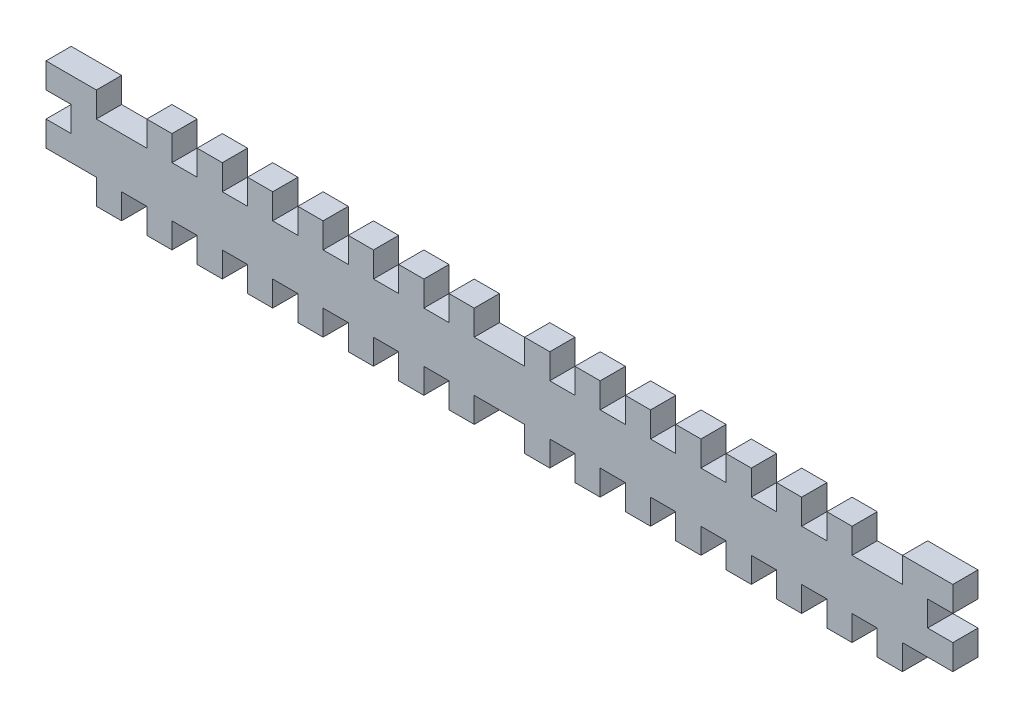
from build123d import *

# Parameters (mm, degrees)
BOSS_EXTRUDE1_DEPTH = 6.35


with BuildPart() as part:
    # Sketch1 → Boss-Extrude1 (new body)
    with BuildSketch(Plane.XY):
        Polygon((-107.95, 0), (-114.3, 0), (-114.3, -6.35), (-101.6, -6.35), (-101.6, -12.7), (-95.25, -12.7), (-95.25, -6.35), (-88.9, -6.35), (-88.9, -12.7), (-82.55, -12.7), (-82.55, -6.35), (-76.2, -6.35), (-76.2, -12.7), (-69.85, -12.7), (-69.85, -6.35), (-63.5, -6.35), (-63.5, -12.7), (-57.15, -12.7), (-57.15, -6.35), (-50.8, -6.35), (-50.8, -12.7), (-44.45, -12.7), (-44.45, -6.35), (-38.1, -6.35), (-38.1, -12.7), (-31.75, -12.7), (-31.75, -6.35), (-25.4, -6.35), (-25.4, -12.7), (-19.05, -12.7), (-19.05, -6.35), (-12.7, -6.35), (-12.7, -12.7), (-6.35, -12.7), (-6.35, -6.35), (0, -6.35), (6.35, -6.35), (6.35, -12.7), (12.7, -12.7), (12.7, -6.35), (19.05, -6.35), (19.05, -12.7), (25.4, -12.7), (25.4, -6.35), (31.75, -6.35), (31.75, -12.7), (38.1, -12.7), (38.1, -6.35), (44.45, -6.35), (44.45, -12.7), (50.8, -12.7), (50.8, -6.35), (57.15, -6.35), (57.15, -12.7), (63.5, -12.7), (63.5, -6.35), (69.85, -6.35), (69.85, -12.7), (76.2, -12.7), (76.2, -6.35), (82.55, -6.35), (82.55, -12.7), (88.9, -12.7), (88.9, -6.35), (95.25, -6.35), (95.25, -12.7), (101.6, -12.7), (101.6, -6.35), (114.3, -6.35), (114.3, 0), (107.95, 0), (107.95, 6.35), (114.3, 6.35), (114.3, 12.7), (107.95, 12.7), (101.6, 12.7), (101.6, 6.35), (95.25, 6.35), (88.9, 6.35), (88.9, 12.7), (82.55, 12.7), (82.55, 6.35), (76.2, 6.35), (76.2, 12.7), (69.85, 12.7), (69.85, 6.35), (63.5, 6.35), (63.5, 12.7), (57.15, 12.7), (57.15, 6.35), (50.8, 6.35), (50.8, 12.7), (44.45, 12.7), (44.45, 6.35), (38.1, 6.35), (38.1, 12.7), (31.75, 12.7), (31.75, 6.35), (25.4, 6.35), (25.4, 12.7), (19.05, 12.7), (19.05, 6.35), (12.7, 6.35), (12.7, 12.7), (6.35, 12.7), (6.35, 6.35), (0, 6.35), (-6.35, 6.35), (-6.35, 12.7), (-12.7, 12.7), (-12.7, 6.35), (-19.05, 6.35), (-19.05, 12.7), (-25.4, 12.7), (-25.4, 6.35), (-31.75, 6.35), (-31.75, 12.7), (-38.1, 12.7), (-38.1, 6.35), (-44.45, 6.35), (-44.45, 12.7), (-50.8, 12.7), (-50.8, 6.35), (-57.15, 6.35), (-57.15, 12.7), (-63.5, 12.7), (-63.5, 6.35), (-69.85, 6.35), (-69.85, 12.7), (-76.2, 12.7), (-76.2, 6.35), (-82.55, 6.35), (-82.55, 12.7), (-88.9, 12.7), (-88.9, 6.35), (-95.25, 6.35), (-101.6, 6.35), (-101.6, 12.7), (-107.95, 12.7), (-114.3, 12.7), (-114.3, 6.35), (-107.95, 6.35), align=None)
    extrude(amount=BOSS_EXTRUDE1_DEPTH)


solid = part.part
